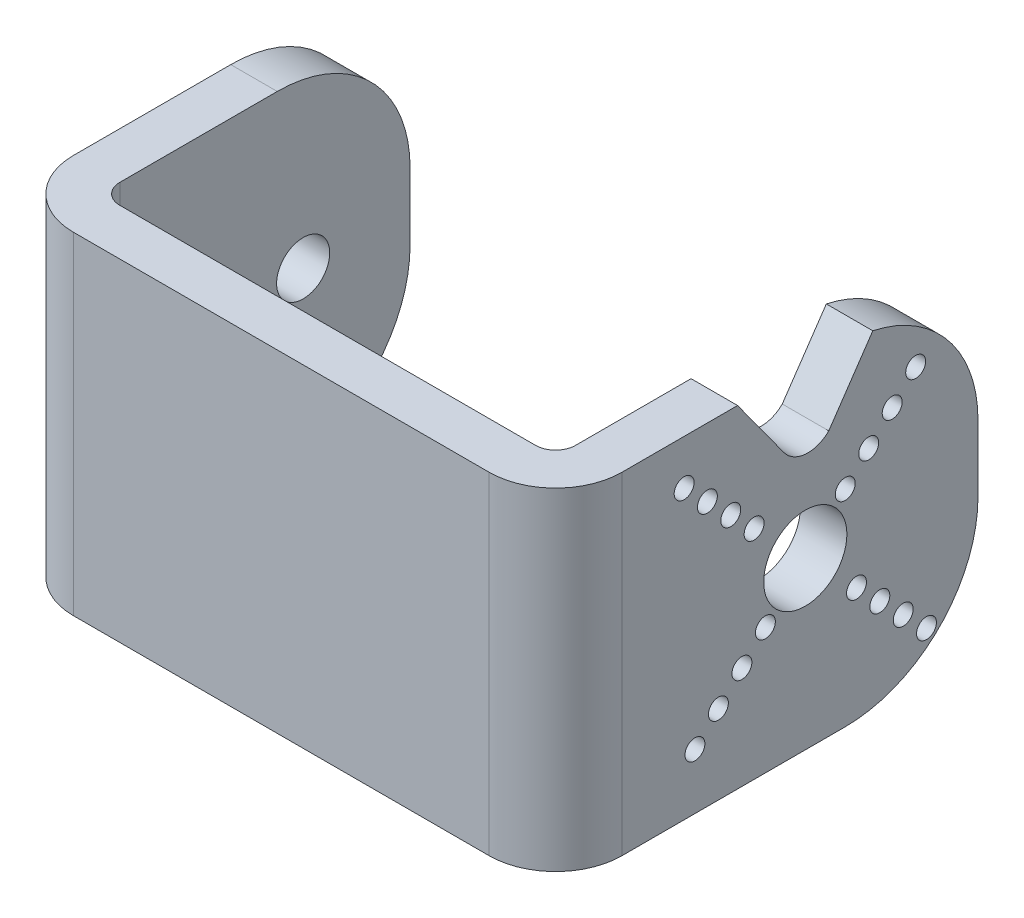
from build123d import *

# Parameters (mm, degrees)
BOSS_EXTRUDE1_DEPTH     = 50
FILLET2_R               = 20
SKETCH6_R               = 6.261637428
SKETCH6_R_2             = 1.5
CUT_EXTRUDE2_DEPTH      = 28.4
SKETCH6_3_R             = 4
CUT_EXTRUDE3_DEPTH      = 136.4
CUT_EXTRUDE4_DEPTH      = 116.893533958
CUT_EXTRUDE4_DEPTH_BACK = 26.4


with BuildPart() as part:
    # Sketch1 → Boss-Extrude1 (new body)
    with BuildSketch(Plane(origin=(0, 0, 0), x_dir=(1, 0, 0), z_dir=(0, 1, 0))):
        with BuildLine():
            Line((-56.375697839, 54.197981352), (-56.375697839, 10.497981352))
            ThreePointArc((-56.375697839, 10.497981352), (-53.44676565, 3.42691354), (-46.375697839, 0.497981352))
            Line((-46.375697839, 0.497981352), (16.224302161, 0.497981352))
            ThreePointArc((16.224302161, 0.497981352), (23.295369973, 3.42691354), (26.224302161, 10.497981352))
            Line((26.224302161, 10.497981352), (26.224302161, 64.097981352))
            Line((26.224302161, 64.097981352), (19.224302161, 64.097981352))
            Line((19.224302161, 64.097981352), (19.224302161, 10.497981352))
            ThreePointArc((19.224302161, 10.497981352), (18.345622505, 8.376661008), (16.224302161, 7.497981352))
            Line((16.224302161, 7.497981352), (-46.375697839, 7.497981352))
            ThreePointArc((-46.375697839, 7.497981352), (-48.497018182, 8.376661008), (-49.375697839, 10.497981352))
            Line((-49.375697839, 10.497981352), (-49.375697839, 54.197981352))
            Line((-49.375697839, 54.197981352), (-56.375697839, 54.197981352))
        make_face()
    extrude(amount=BOSS_EXTRUDE1_DEPTH)

    # Fillet2
    fillet2_edges = [part.edges().sort_by_distance(p)[0] for p in [
        (-52.875697839, 50, -54.197981352),
        (-52.875697839, 0, -54.197981352),
        (22.724302161, 0, -64.097981352),
        (22.724302161, 50, -64.097981352),
    ]]
    fillet(fillet2_edges, radius=FILLET2_R)

    # Sketch6 → Cut-Extrude2 (cut)
    with BuildSketch(Plane(origin=(26.224302161, 0, 0), x_dir=(0, 0, -1), z_dir=(1, 0, 0))):
        with Locations((38.097981352, 25)):
            Circle(SKETCH6_R)
        with Locations((19.854626397, 43.243354955)):
            Circle(SKETCH6_R_2)
        with Locations((23.354804964, 39.743176388)):
            Circle(SKETCH6_R_2)
        with Locations((26.876196734, 36.221784617)):
            Circle(SKETCH6_R_2)
        with Locations((30.390517437, 32.707463915)):
            Circle(SKETCH6_R_2)
        with Locations((32.087573711, 18.98959236)):
            Circle(SKETCH6_R_2)
        with Locations((28.552039805, 15.454058454)):
            Circle(SKETCH6_R_2)
        with Locations((25.0165059, 11.918524548)):
            Circle(SKETCH6_R_2)
        with Locations((21.480971994, 8.382990642)):
            Circle(SKETCH6_R_2)
        with Locations((44.108388992, 31.01040764)):
            Circle(SKETCH6_R_2)
        with Locations((47.643922898, 34.545941546)):
            Circle(SKETCH6_R_2)
        with Locations((51.179456803, 38.081475452)):
            Circle(SKETCH6_R_2)
        with Locations((54.714990709, 41.617009358)):
            Circle(SKETCH6_R_2)
        with Locations((56.341336306, 6.756645045)):
            Circle(SKETCH6_R_2)
        with Locations((52.841157739, 10.256823612)):
            Circle(SKETCH6_R_2)
        with Locations((49.319765969, 13.778215383)):
            Circle(SKETCH6_R_2)
        with Locations((45.805445266, 17.292536085)):
            Circle(SKETCH6_R_2)
    extrude(amount=-CUT_EXTRUDE2_DEPTH, mode=Mode.SUBTRACT)

    # Sketch6<3> → Cut-Extrude3 (cut)
    with BuildSketch(Plane(origin=(26.224302161, 0, 0), x_dir=(0, 0, -1), z_dir=(1, 0, 0))):
        with Locations((38.097981352, 25)):
            Circle(SKETCH6_3_R)
    extrude(amount=-CUT_EXTRUDE3_DEPTH, mode=Mode.SUBTRACT)

    # Sketch7 → Cut-Extrude4 (cut, two sides: drawn at the far end of the back side and taken through both)
    with BuildSketch(Plane(origin=(26.224302161, 0, 0), x_dir=(0, 0, -1), z_dir=(1, 0, 0)).offset(-CUT_EXTRUDE4_DEPTH_BACK)):
        with BuildLine():
            Line((44.097981352, 50), (27.901409821, 50))
            Line((27.901409821, 50), (34.889942889, 40.363586132))
            ThreePointArc((34.889942889, 40.363586132), (38.136702541, 38.542544558), (41.629478365, 39.830239282))
            Line((41.629478365, 39.830239282), (48.26230961, 49.561655609))
            ThreePointArc((48.26230961, 49.561655609), (46.191648926, 49.890112018), (44.097981352, 50))
        make_face()
    extrude(amount=CUT_EXTRUDE4_DEPTH + CUT_EXTRUDE4_DEPTH_BACK, mode=Mode.SUBTRACT)


solid = part.part
